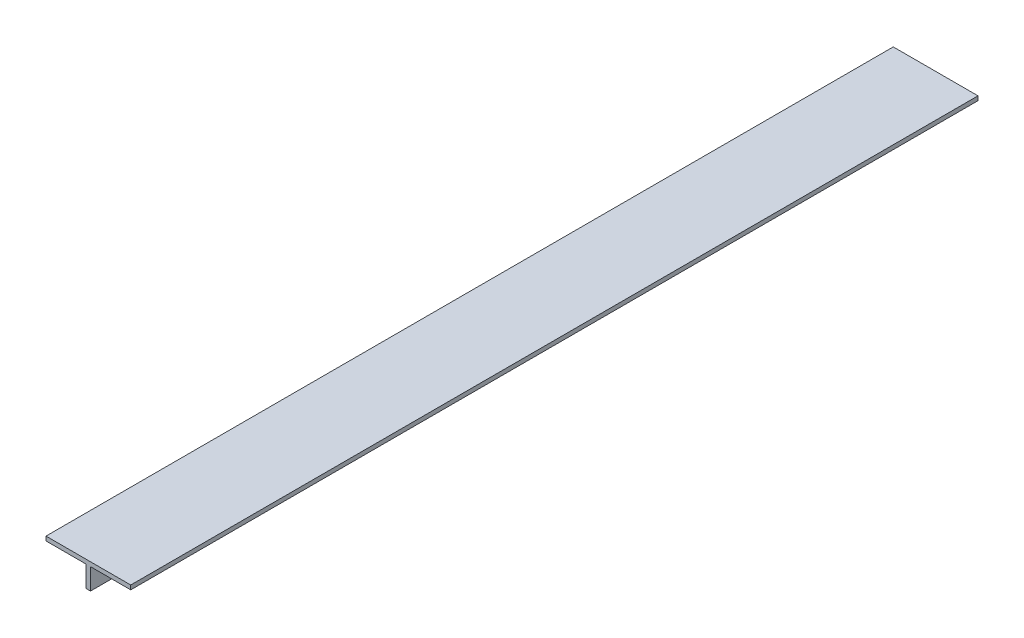
from build123d import *

# Parameters (mm, degrees)
EXTRUDE1_DEPTH = 50800


with BuildPart() as part:
    # Sketch1 → Extrude1 (new body)
    with BuildSketch(Plane.XY):
        Polygon((0, 0), (5080, 0), (5080, -254), (2667, -254), (2667, -1524), (2413, -1524), (2413, -254), (0, -254), align=None)
    extrude(amount=EXTRUDE1_DEPTH)


solid = part.part
